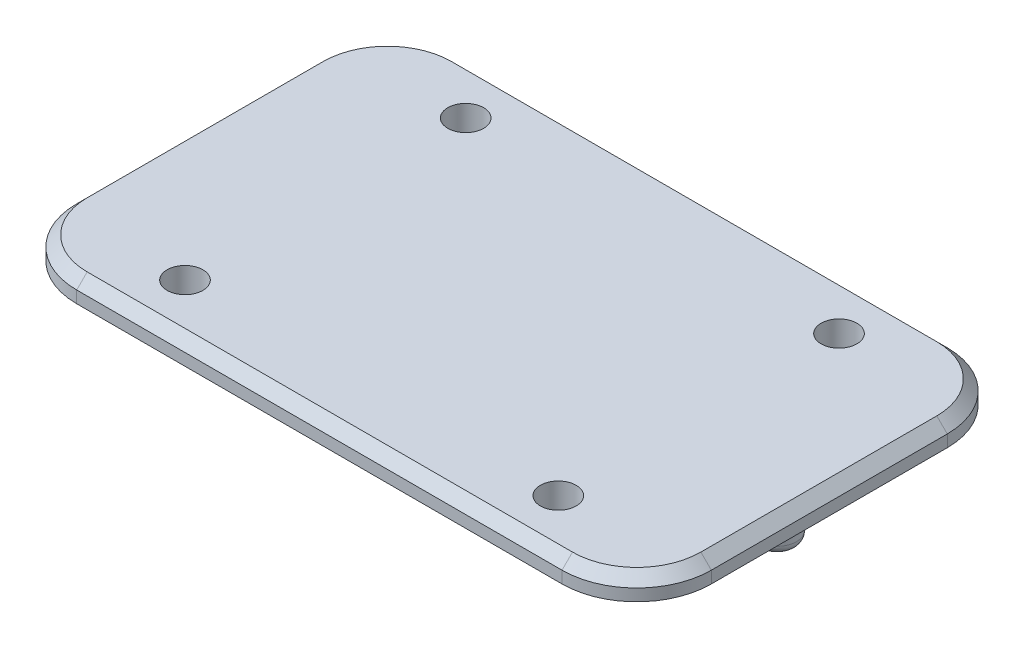
from build123d import *

# Parameters (mm, degrees)
SKETCH2_W           = 42.5
SKETCH2_H           = 25.8
BOSS_EXTRUDE1_DEPTH = 1.5
FILLET1_R           = 5
CHAMFER1_SIZE       = 0.7
BOSS_EXTRUDE2_DEPTH = 1.5
BOSS_EXTRUDE3_DEPTH = 1.7
FILLET2_R           = 0.6
SKETCH5_R           = 1.2
CUT_EXTRUDE1_DEPTH  = 26.039418923


with BuildPart() as part:
    # Sketch2 → Boss-Extrude1 (new body)
    with BuildSketch(Plane(origin=(0, 0, 0), x_dir=(1, 0, 0), z_dir=(0, 1, 0))):
        Rectangle(SKETCH2_W, SKETCH2_H)
    extrude(amount=BOSS_EXTRUDE1_DEPTH)

    # Fillet1
    fillet1_edges = [part.edges().sort_by_distance(p)[0] for p in [
        (21.25, 0.75, -12.9),
        (21.25, 0.75, 12.9),
        (-21.25, 0.75, 12.9),
        (-21.25, 0.75, -12.9),
    ]]
    fillet(fillet1_edges, radius=FILLET1_R)

    # Chamfer1
    chamfer1_edges = [part.edges().sort_by_distance(p)[0] for p in [
        (21.25, 1.5, 0),
        (0, 1.5, 12.9),
        (0, 1.5, -12.9),
        (-21.25, 1.5, 0),
        (-19.785533906, 1.5, 11.435533906),
        (-19.785533906, 1.5, -11.435533906),
        (19.785533906, 1.5, -11.435533906),
        (19.785533906, 1.5, 11.435533906),
    ]]
    chamfer(chamfer1_edges, length=CHAMFER1_SIZE)

    # Sketch3 → Boss-Extrude2 (add)
    with BuildSketch(Plane(origin=(0, 0, 0), x_dir=(1, 0, 0), z_dir=(0, 1, 0))):
        with BuildLine():
            Line((17.75, 1.3), (-17.75, 1.3))
            ThreePointArc((-17.75, 1.3), (-19.05, 0), (-17.75, -1.3))
            Line((-17.75, -1.3), (17.75, -1.3))
            ThreePointArc((17.75, -1.3), (19.05, 0), (17.75, 1.3))
        make_face()
        with BuildLine():
            Line((12.5, 10.7), (-12.5, 10.7))
            ThreePointArc((-12.5, 10.7), (-13.8, 9.4), (-12.5, 8.1))
            Line((-12.5, 8.1), (12.5, 8.1))
            ThreePointArc((12.5, 8.1), (13.8, 9.4), (12.5, 10.7))
        make_face()
        with BuildLine():
            Line((12.5, -8.1), (-12.5, -8.1))
            ThreePointArc((-12.5, -8.1), (-13.8, -9.4), (-12.5, -10.7))
            Line((-12.5, -10.7), (12.5, -10.7))
            ThreePointArc((12.5, -10.7), (13.8, -9.4), (12.5, -8.1))
        make_face()
    extrude(amount=-BOSS_EXTRUDE2_DEPTH)

    # Sketch4 → Boss-Extrude3 (add)
    with BuildSketch(Plane.XZ.offset(1.5)):
        with BuildLine():
            Line((17.75, 1.3), (-17.75, 1.3))
            ThreePointArc((-17.75, 1.3), (-19.05, 0), (-17.75, -1.3))
            Line((-17.75, -1.3), (17.75, -1.3))
            ThreePointArc((17.75, -1.3), (19.05, 0), (17.75, 1.3))
        make_face()
    extrude(amount=BOSS_EXTRUDE3_DEPTH)

    # Fillet2
    fillet2_edges = [part.edges().sort_by_distance(p)[0] for p in [
        (0, -3.2, -1.3),
        (-19.05, -3.2, 0),
        (0, -3.2, 1.3),
        (19.05, -3.2, 0),
    ]]
    fillet(fillet2_edges, radius=FILLET2_R)

    # Sketch5 → Cut-Extrude1 (cut, through all)
    with BuildSketch(Plane.XZ.offset(1.5)):
        with Locations(Location((-12.5, 9.4, 0), (0, 0, 270))):
            Circle(SKETCH5_R)
        with Locations(Location((12.5, 9.4, 0), (0, 0, 270))):
            Circle(SKETCH5_R)
        with Locations(Location((12.5, -9.4, 0), (0, 0, 270))):
            Circle(SKETCH5_R)
        with Locations(Location((-12.5, -9.4, 0), (0, 0, 270))):
            Circle(SKETCH5_R)
    extrude(amount=-CUT_EXTRUDE1_DEPTH, mode=Mode.SUBTRACT)


solid = part.part
